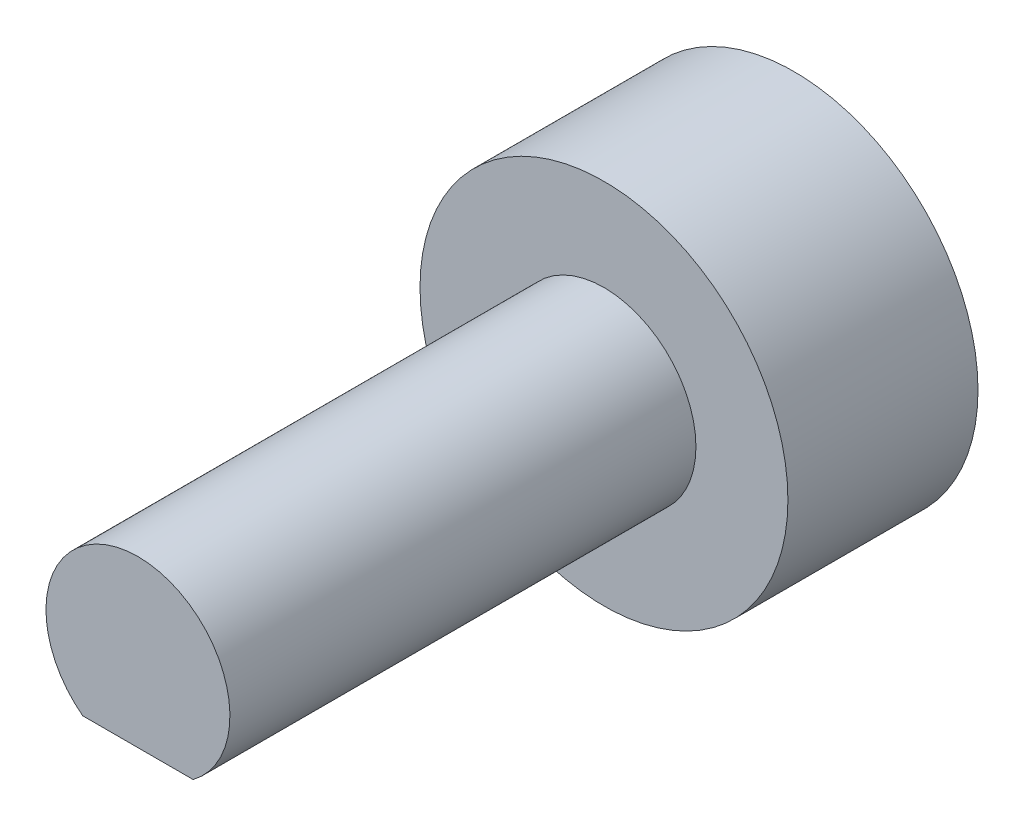
from build123d import *

# Parameters (mm, degrees)
CROQUIS2_R                 = 6
SALIENTE_EXTRUIR1_DEPTH    = 6.2
CROQUIS3_R                 = 3
SALIENTE_EXTRUIR2_DEPTH    = 15.2
CORTAR_EXTRUIR1_DEPTH      = 24.020860106
CORTAR_EXTRUIR1_DEPTH_BACK = 12.2


with BuildPart() as part:
    # Croquis2 → Saliente-Extruir1 (new body)
    with BuildSketch(Plane.XY):
        Circle(CROQUIS2_R)
    extrude(amount=-SALIENTE_EXTRUIR1_DEPTH)

    # Croquis3 → Saliente-Extruir2 (add)
    with BuildSketch(Plane.XY):
        with Locations(Location((0, 0, 0), (0, 0, 180))):
            Circle(CROQUIS3_R)
    extrude(amount=SALIENTE_EXTRUIR2_DEPTH)

    # Croquis4 → Cortar-Extruir1 (cut, two sides: drawn at the far end of the back side and taken through both)
    with BuildSketch(Plane.XY.offset(15.2).offset(-CORTAR_EXTRUIR1_DEPTH_BACK)):
        Polygon((34.725967809, -2.4), (1.8, -2.4), (-1.8, -2.4), (-34.725967809, -2.4), (-34.725967809, -68.251935619), (34.725967809, -68.251935619), align=None)
    extrude(amount=CORTAR_EXTRUIR1_DEPTH + CORTAR_EXTRUIR1_DEPTH_BACK, mode=Mode.SUBTRACT)


solid = part.part
